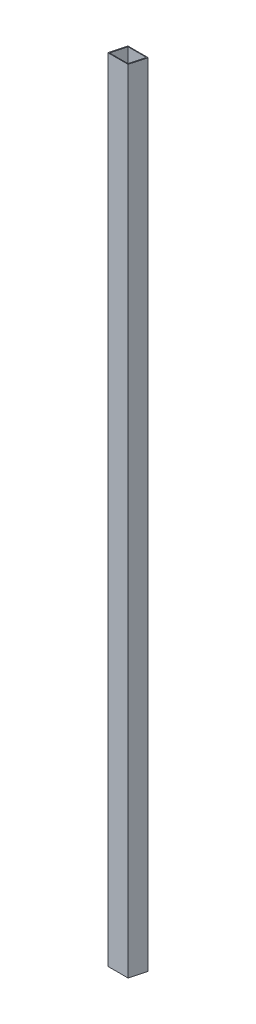
from build123d import *

# Parameters (mm, degrees)
SKETCH1_W           = 25
SKETCH1_H           = 25
SKETCH1_W_2         = 23
SKETCH1_H_2         = 23
BOSS_EXTRUDE1_DEPTH = 1200
CUT_EXTRUDE1_DEPTH  = 1201.325476694


with BuildPart() as part:
    # Sketch1 → Boss-Extrude1 (new body)
    with BuildSketch(Plane(origin=(0, 0, 0), x_dir=(1, 0, 0), z_dir=(0, 1, 0))):
        Rectangle(SKETCH1_W, SKETCH1_H)
        Rectangle(SKETCH1_W_2, SKETCH1_H_2, mode=Mode.SUBTRACT)
    extrude(amount=BOSS_EXTRUDE1_DEPTH)

    # Sketch2 → Cut-Extrude1 (cut, through all)
    with BuildSketch(Plane(origin=(12.5, 0, 0), x_dir=(0, 0, -1), z_dir=(1, 0, 0))):
        Polygon((12.5, 0), (-12.5, 5.313914042), (-12.5, 0), align=None)
        Polygon((12.5, 1200), (-12.5, 1200), (-12.5, 986.760885112), (12.5, 981.44697107), align=None)
    extrude(amount=-CUT_EXTRUDE1_DEPTH, mode=Mode.SUBTRACT)


solid = part.part
